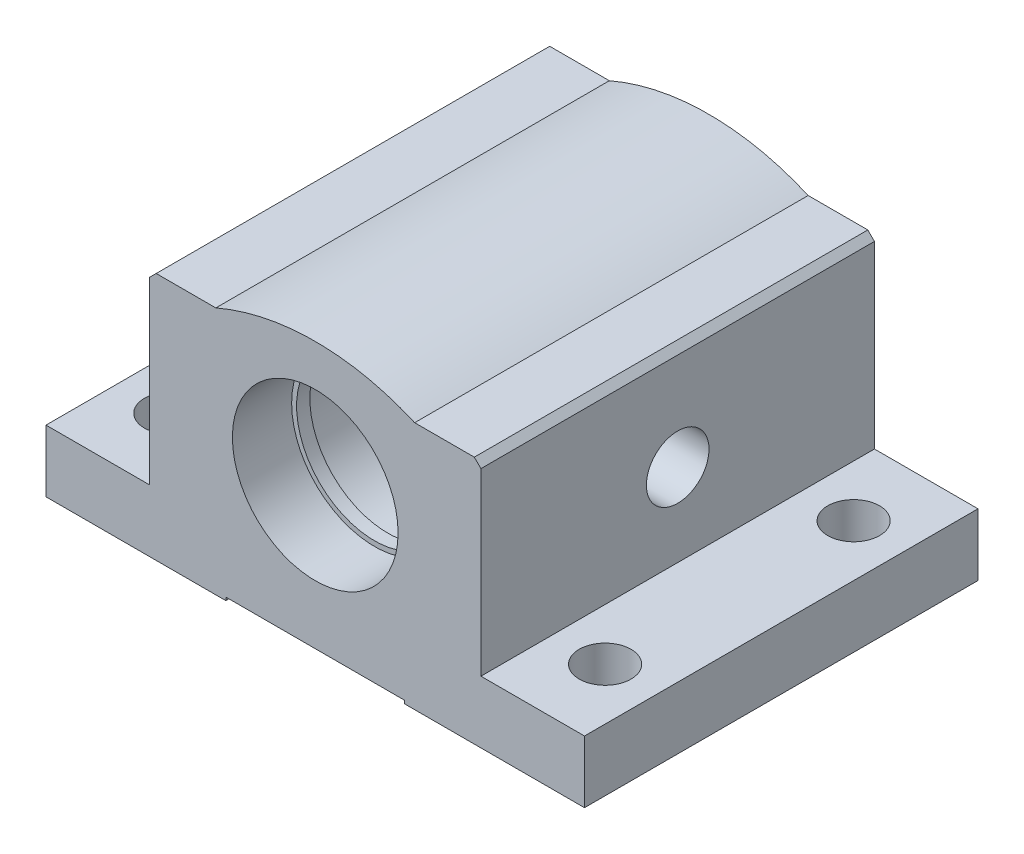
from build123d import *

# Parameters (mm, degrees)
BOSS_EXTRUDE1_START     = -15.08125
SKETCH4_R               = 6.35
BOSS_EXTRUDE1_DEPTH     = 30.1625
SKETCH5_R               = 1.984375
CUT_EXTRUDE1_DEPTH      = 31.089302631
CHAMFER1_SIZE           = 0.508
SKETCH6_R               = 6.731
CUT_EXTRUDE2_DEPTH      = 1.016
CUT_EXTRUDE3_REACH      = 40.017
CUT_EXTRUDE3_END_RADIUS = 6.35
SKETCH7_R               = 2.4003
SKETCH8_R               = 0.376075682
BOSS_EXTRUDE2_DEPTH     = 1.016


with BuildPart() as part:
    # Sketch4 → Boss-Extrude1 (new body)
    with BuildSketch(Plane.XY.offset(BOSS_EXTRUDE1_START)):
        with BuildLine():
            Line((-20.6375, -5.55625), (-12.7, -5.55625))
            Line((-12.7, -5.55625), (-12.7, 8.73125))
            Line((-12.7, 8.73125), (-7.62, 8.73125))
            ThreePointArc((-7.62, 8.73125), (0, 10.31875), (7.62, 8.73125))
            Line((7.62, 8.73125), (12.7, 8.73125))
            Line((12.7, 8.73125), (12.7, -5.55625))
            Line((12.7, -5.55625), (20.6375, -5.55625))
            Line((20.6375, -5.55625), (20.6375, -10.31875))
            Line((20.6375, -10.31875), (6.858, -10.31875))
            Line((6.858, -10.31875), (6.858, -10.080625))
            Line((6.858, -10.080625), (-6.858, -10.080625))
            Line((-6.858, -10.080625), (-6.858, -10.31875))
            Line((-6.858, -10.31875), (-20.6375, -10.31875))
            Line((-20.6375, -10.31875), (-20.6375, -5.55625))
        make_face()
        with Locations(Location((0, 0.78105, 0), (0, 0, 180))):
            Circle(SKETCH4_R, mode=Mode.SUBTRACT)
    extrude(amount=BOSS_EXTRUDE1_DEPTH)

    # Sketch5 → Cut-Extrude1 (cut, through all)
    with BuildSketch(Plane(origin=(0, -5.55625, 0), x_dir=(1, 0, 0), z_dir=(0, 1, 0))):
        with Locations(Location((-16.6624, 9.525, 0), (0, 0, 180))):
            Circle(SKETCH5_R)
        with Locations(Location((16.6624, 9.525, 0), (0, 0, 180))):
            Circle(SKETCH5_R)
        with Locations(Location((16.6624, -9.525, 0), (0, 0, 180))):
            Circle(SKETCH5_R)
        with Locations(Location((-16.6624, -9.525, 0), (0, 0, 180))):
            Circle(SKETCH5_R)
    extrude(amount=-CUT_EXTRUDE1_DEPTH, mode=Mode.SUBTRACT)

    # Chamfer1
    chamfer1_edges = [part.edges().sort_by_distance(p)[0] for p in [
        (-12.7, 8.73125, 0),
        (12.7, 8.73125, 0),
    ]]
    chamfer(chamfer1_edges, length=CHAMFER1_SIZE)

    # Sketch6 → Cut-Extrude2 (cut)
    with BuildSketch(Plane.XY.offset(9.525)):
        with Locations((0, 0.78105)):
            Circle(SKETCH6_R)
    cut_extrude2 = extrude(amount=CUT_EXTRUDE2_DEPTH, mode=Mode.SUBTRACT)

    # Mirror1: Cut-Extrude2 across plane
    add(cut_extrude2.mirror(Plane.XY), mode=Mode.SUBTRACT)

    # Cut-Extrude3: up to this cylinder (the profile starts outside it)
    cut_extrude3_end = Plane(origin=(0, 0.78105, 0), z_dir=(0, 0, -1)) * Cylinder(CUT_EXTRUDE3_END_RADIUS, 93.734, mode=Mode.PRIVATE)
    # Sketch7 → Cut-Extrude3 (cut, up to the surface)
    with BuildSketch(Plane(origin=(12.7, 0, 0), x_dir=(0, 0, -1), z_dir=(1, 0, 0)), mode=Mode.PRIVATE) as cut_extrude3_sk1:
        with Locations((0, 0.78105)):
            Circle(SKETCH7_R)
    cut_extrude3_tool1 = extrude(cut_extrude3_sk1.sketch, amount=-CUT_EXTRUDE3_REACH, mode=Mode.PRIVATE) - cut_extrude3_end
    add(cut_extrude3_tool1.solids().sort_by_distance((12.7, 0.78105, 0))[0], mode=Mode.SUBTRACT)


with BuildPart() as body_2:
    # Sketch8 → Boss-Extrude2 (new body)
    with BuildSketch(Plane.XY.offset(9.525)):
        with BuildLine():
            Line((-2.498354039, 5.615722541), (-2.942132023, 6.83499253))
            ThreePointArc((-2.942132023, 6.83499253), (-3.904842357, 6.263619395), (-4.759535744, 5.540585744))
            ThreePointArc((-4.759535744, 5.540585744), (0, -5.94995), (4.759535744, 5.540585744))
            ThreePointArc((4.759535744, 5.540585744), (3.904842357, 6.263619395), (2.942132023, 6.83499253))
            Line((2.942132023, 6.83499253), (2.498354039, 5.615722541))
            ThreePointArc((2.498354039, 5.615722541), (2.773728827, 4.742345296), (3.688618704, 4.78229025))
            Line((3.688618704, 4.78229025), (3.963565495, 5.012998002))
            ThreePointArc((3.963565495, 5.012998002), (4.094326028, 5.057385221), (4.220720377, 5.001770377))
            ThreePointArc((4.220720377, 5.001770377), (0, -5.18795), (-4.220720377, 5.001770377))
            ThreePointArc((-4.220720377, 5.001770377), (-4.094326028, 5.057385221), (-3.963565495, 5.012998002))
            Line((-3.963565495, 5.012998002), (-3.688618704, 4.78229025))
            ThreePointArc((-3.688618704, 4.78229025), (-2.773728827, 4.742345296), (-2.498354039, 5.615722541))
        make_face()
        with Locations((-3.205145126, 5.358471623)):
            Circle(SKETCH8_R, mode=Mode.SUBTRACT)
        with Locations(Location((3.205145126, 5.358471623, 0), (0, 0, 180))):
            Circle(SKETCH8_R, mode=Mode.SUBTRACT)
    extrude(amount=BOSS_EXTRUDE2_DEPTH)


with BuildPart() as body_3:
    # Mirror2: mirrored copy
    add(body_2.part.mirror(Plane.XY))


solid = Compound([part.part, body_2.part, body_3.part])
